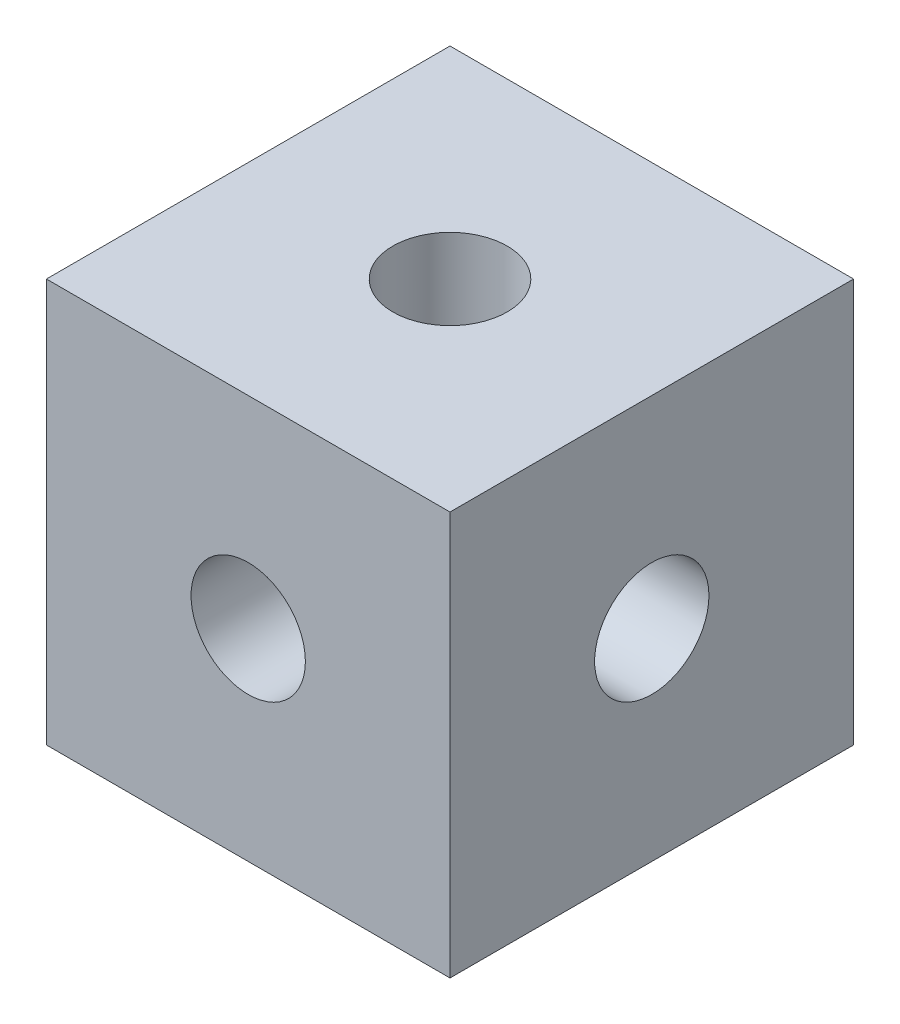
from build123d import *

# Parameters (mm, degrees)
SKETCH1_W            = 12
SKETCH1_H            = 12
BOSS_EXTRUDE1_DEPTH  = 12
M3_CLEARANCE_HOLE1_D = 3.4
M3_CLEARANCE_HOLE2_D = 3.4
M3_CLEARANCE_HOLE3_D = 3.4


with BuildPart() as part:
    # Sketch1 → Boss-Extrude1 (new body)
    with BuildSketch(Plane(origin=(0, 0, 0), x_dir=(1, 0, 0), z_dir=(0, 1, 0))):
        Rectangle(SKETCH1_W, SKETCH1_H)
    extrude(amount=BOSS_EXTRUDE1_DEPTH)

    # M3 Clearance Hole1 (through all)
    with Locations(Plane.XY.offset(6)):
        with Locations((0, 6)):
            Hole(M3_CLEARANCE_HOLE1_D / 2)

    # M3 Clearance Hole2 (through all)
    with Locations(Plane(origin=(6, 0, 0), x_dir=(0, 0, -1), z_dir=(1, 0, 0))):
        with Locations((0, 6)):
            Hole(M3_CLEARANCE_HOLE2_D / 2)

    # M3 Clearance Hole3 (through all)
    with Locations(Plane(origin=(0, 12, 0), x_dir=(1, 0, 0), z_dir=(0, 1, 0))):
        with Locations((0, 0)):
            Hole(M3_CLEARANCE_HOLE3_D / 2)


solid = part.part
